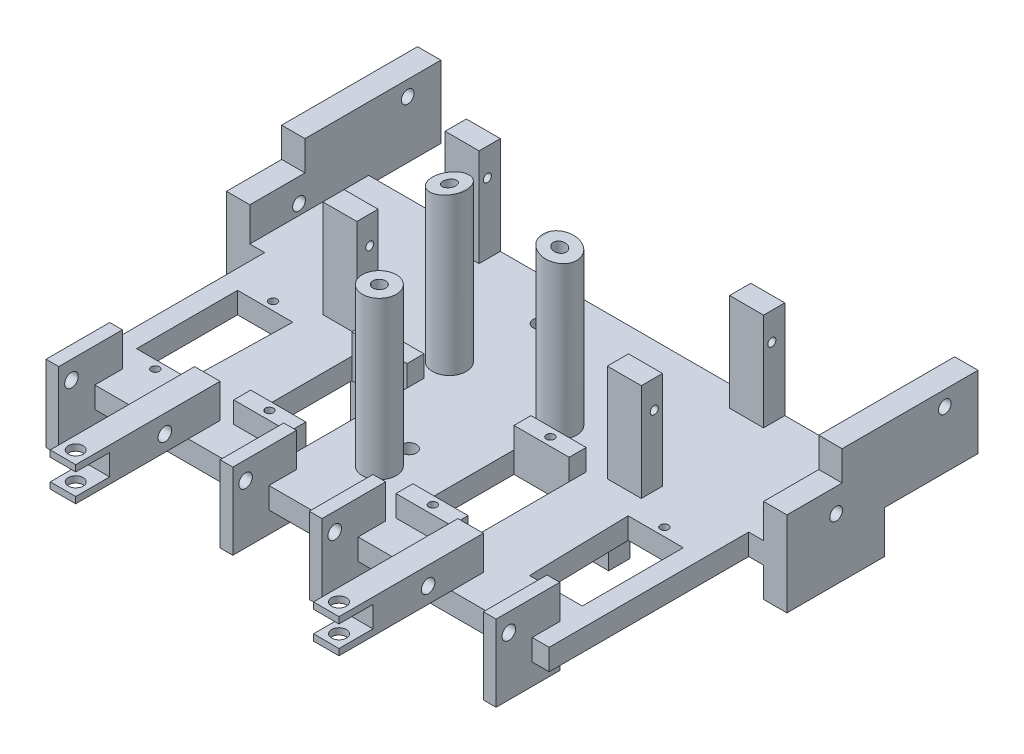
from build123d import *

# Parameters (mm, degrees)
SKETCH_1_W           = 114
SKETCH_1_H           = 75
EXTRUDE_1_DEPTH      = 5
SKETCH_4_W           = 121
SKETCH_4_H           = 28
EXTRUDE_4_DEPTH      = 5
SKETCH_5_W           = 23
SKETCH_5_H           = 20
EXTRUDE_5_DEPTH      = 5.5
SKETCH_6_W           = 32
SKETCH_6_H           = 17
EXTRUDE_6_DEPTH      = 5.5
SKETCH_8_W           = 8
SKETCH_8_H           = 5
EXTRUDE_7_DEPTH      = 23
EXTRUDE_START        = -10
SKETCH_9_W           = 3
SKETCH_9_H           = 15
EXTRUDE_8_DEPTH      = 18
SKETCH_10_W          = 3
SKETCH_10_H          = 15
EXTRUDE_9_DEPTH      = 18
SKETCH_11_W          = 6
SKETCH_11_H          = 34
EXTRUDE_10_DEPTH     = 8
SKETCH_12_R          = 4
EXTRUDE_11_DEPTH     = 37
CUT_EXTRUDE_8_REACH  = 126.354
SKETCH_19_R          = 0.95
SKETCH_25_R          = 4
EXTRUDE_14_DEPTH     = 37
CUT_EXTRUDE_14_DEPTH = 36
SKETCH_28_W          = 6
SKETCH_28_H          = 5
CUT_EXTRUDE_16_DEPTH = 8
SKETCH_29_R          = 1.75
CUT_EXTRUDE_17_DEPTH = 8
SKETCH_30_R          = 1.6
CUT_EXTRUDE_18_DEPTH = 48
SKETCH_31_R          = 1.75
CUT_EXTRUDE_19_DEPTH = 20
SKETCH_35_R          = 1.5
CUT_EXTRUDE_23_DEPTH = 15
SKETCH_36_R          = 0.95
SKETCH_36_W          = 13
SKETCH_36_H          = 23.8
CUT_EXTRUDE_24_DEPTH = 7
SKETCH_37_W          = 6
SKETCH_37_H          = 5
SKETCH_37_W_2        = 5.306431403
EXTRUDE_15_DEPTH     = 13
SKETCH_38_R          = 0.95
CUT_EXTRUDE_25_DEPTH = 13
SKETCH_43_W          = 33.306431403
SKETCH_43_H          = 36.401816986
SKETCH_43_W_2        = 5.306431403
SKETCH_43_H_2        = 5
SKETCH_43_W_3        = 6
CUT_EXTRUDE_28_DEPTH = 2
EXTRUDE_START_2      = 5
SKETCH_41_W          = 13
SKETCH_41_H          = 4
SKETCH_41_R          = 0.95
EXTRUDE_16_DEPTH     = 5
CUT_EXTRUDE_START    = -13
SKETCH_39_R          = 1.5
CUT_EXTRUDE_26_DEPTH = 55


with BuildPart() as part:
    # 草图1 → 凸台-拉伸1 (new body)
    with BuildSketch(Plane(origin=(0, 0, 0), x_dir=(1, 0, 0), z_dir=(0, 1, 0))):
        Rectangle(SKETCH_1_W, SKETCH_1_H)
    extrude(amount=EXTRUDE_1_DEPTH)

    # 草图4 → 凸台-拉伸4 (add)
    with BuildSketch(Plane(origin=(0, 5, 0), x_dir=(1, 0, 0), z_dir=(0, 1, 0))):
        with Locations((0, 23.5)):
            Rectangle(SKETCH_4_W, SKETCH_4_H)
    extrude(amount=-EXTRUDE_4_DEPTH)

    # 草图5 → 凸台-拉伸5 (add)
    with BuildSketch(Plane.ZY.offset(60.5)):
        with Locations((-21, 3)):
            Rectangle(SKETCH_5_W, SKETCH_5_H)
    extrude_5 = extrude(amount=EXTRUDE_5_DEPTH)

    # 草图6 → 凸台-拉伸6 (add)
    with BuildSketch(Plane.ZY.offset(60.5)):
        with Locations((-38.5, 11.5)):
            Rectangle(SKETCH_6_W, SKETCH_6_H)
    extrude_6 = extrude(amount=EXTRUDE_6_DEPTH)

    # 草图8 → 凸台-拉伸7 (add)
    with BuildSketch(Plane(origin=(0, 5, 0), x_dir=(1, 0, 0), z_dir=(0, 1, 0))):
        with Locations((-33.5, 35)):
            Rectangle(SKETCH_8_W, SKETCH_8_H)
        with Locations((-33.5, 6.2)):
            Rectangle(SKETCH_8_W, SKETCH_8_H)
    extrude_7 = extrude(amount=EXTRUDE_7_DEPTH)

    # 草图9 → 凸台-拉伸8 (add)
    with BuildSketch(Plane(origin=(0, 5, 0), x_dir=(1, 0, 0), z_dir=(0, 1, 0)).offset(EXTRUDE_START)):
        with Locations((-10.5, -38.5)):
            Rectangle(SKETCH_9_W, SKETCH_9_H)
    extrude_8 = extrude(amount=EXTRUDE_8_DEPTH)

    # 草图10 → 凸台-拉伸9 (add)
    with BuildSketch(Plane(origin=(0, 5, 0), x_dir=(1, 0, 0), z_dir=(0, 1, 0)).offset(EXTRUDE_START)):
        with Locations((-51.5, -38.5)):
            Rectangle(SKETCH_10_W, SKETCH_10_H)
    extrude_9 = extrude(amount=EXTRUDE_9_DEPTH)

    # 草图11 → 凸台-拉伸10 (add)
    with BuildSketch(Plane(origin=(0, 5, 0), x_dir=(1, 0, 0), z_dir=(0, 1, 0))):
        with Locations((-31, -47)):
            Rectangle(SKETCH_11_W, SKETCH_11_H)
    extrude_10 = extrude(amount=EXTRUDE_10_DEPTH)

    # 草图12 → 凸台-拉伸11 (add)
    with BuildSketch(Plane(origin=(0, 5, 0), x_dir=(1, 0, 0), z_dir=(0, 1, 0))):
        with Locations(Location((-13, 9, 0), (0, 0, 270))):
            Circle(SKETCH_12_R)
    extrude_11 = extrude(amount=EXTRUDE_11_DEPTH)

    # 草图19 → 切除-拉伸8 (cut, up to next)
    with BuildSketch(Plane.ZY.offset(37.5), mode=Mode.PRIVATE) as cut_extrude_8_sk1:
        with Locations((-6.75, 21.5)):
            Circle(SKETCH_19_R)
    cut_extrude_8_tool1 = extrude(cut_extrude_8_sk1.sketch, amount=-CUT_EXTRUDE_8_REACH, mode=Mode.PRIVATE) & part.part
    # 草图19 → 切除-拉伸8 (cut, up to next)
    with BuildSketch(Plane.ZY.offset(37.5), mode=Mode.PRIVATE) as cut_extrude_8_sk2:
        with Locations((-34.45, 21.5)):
            Circle(SKETCH_19_R)
    cut_extrude_8_tool2 = extrude(cut_extrude_8_sk2.sketch, amount=-CUT_EXTRUDE_8_REACH, mode=Mode.PRIVATE) & part.part
    cut_extrude_8_1 = cut_extrude_8_tool1.solids().sort_by_distance((-37.5, 21.5, -6.75))[0]
    add(cut_extrude_8_1, mode=Mode.SUBTRACT)
    cut_extrude_8_2 = cut_extrude_8_tool2.solids().sort_by_distance((-37.5, 21.5, -34.45))[0]
    add(cut_extrude_8_2, mode=Mode.SUBTRACT)
    cut_extrude_8 = cut_extrude_8_1 + cut_extrude_8_2  # 切除-拉伸8 as one shape, for the pattern or mirror that repeats it

    # 草图25 → 凸台-拉伸14 (add)
    with BuildSketch(Plane(origin=(0, 5, 0), x_dir=(1, 0, 0), z_dir=(0, 1, 0))):
        with Locations(Location((0, -20.5, 0), (0, 0, 270))):
            Circle(SKETCH_25_R)
    extrude(amount=EXTRUDE_14_DEPTH)

    # 草图26 → 切除-拉伸14 (cut)
    with BuildSketch(Plane.XY):
        Polygon((-17, 42), (-17, 40.644045518), (-9.31, 42), align=None)
    cut_extrude_14 = extrude(amount=-CUT_EXTRUDE_14_DEPTH, mode=Mode.SUBTRACT)

    # 草图28 → 切除-拉伸16 (cut)
    with BuildSketch(Plane.XY.offset(64)):
        with Locations((-31, 9)):
            Rectangle(SKETCH_28_W, SKETCH_28_H)
    cut_extrude_16 = extrude(amount=-CUT_EXTRUDE_16_DEPTH, mode=Mode.SUBTRACT)

    # 草图29 → 切除-拉伸17 (cut)
    with BuildSketch(Plane(origin=(0, 13, 0), x_dir=(1, 0, 0), z_dir=(0, 1, 0))):
        with Locations(Location((-31, -61, 0), (0, 0, 270))):
            Circle(SKETCH_29_R)
    cut_extrude_17 = extrude(amount=-CUT_EXTRUDE_17_DEPTH, mode=Mode.SUBTRACT)

    # 草图30 → 切除-拉伸18 (cut)
    with BuildSketch(Plane.ZY.offset(53)):
        with Locations((43, 8.75)):
            Circle(SKETCH_30_R)
    cut_extrude_18 = extrude(amount=-CUT_EXTRUDE_18_DEPTH, mode=Mode.SUBTRACT)

    # 草图31 → 切除-拉伸19 (cut)
    with BuildSketch(Plane(origin=(0, 5, 0), x_dir=(1, 0, 0), z_dir=(0, 1, 0))):
        with Locations(Location((0, -13.5, 0), (0, 0, 270))):
            Circle(SKETCH_31_R)
        with Locations(Location((-10, 27.5, 0), (0, 0, 270))):
            Circle(SKETCH_31_R)
        with Locations(Location((10, 27.5, 0), (0, 0, 270))):
            Circle(SKETCH_31_R)
    extrude(amount=-CUT_EXTRUDE_19_DEPTH, mode=Mode.SUBTRACT)

    # 草图35 → 切除-拉伸23 (cut)
    with BuildSketch(Plane.ZY.offset(66)):
        with Locations((-46.688415906, 16.452713274)):
            Circle(SKETCH_35_R)
        with Locations((-21.089366767, 7.437765567)):
            Circle(SKETCH_35_R)
    cut_extrude_23 = extrude(amount=-CUT_EXTRUDE_23_DEPTH, mode=Mode.SUBTRACT)

    # 草图36 → 切除-拉伸24 (cut)
    with BuildSketch(Plane(origin=(0, 5, 0), x_dir=(1, 0, 0), z_dir=(0, 1, 0))):
        with Locations(Location((-19.235936503, 0.562374715, 0), (0, 0, 270))):
            Circle(SKETCH_36_R)
        with Locations(Location((-19.235936503, -27.137625285, 0), (0, 0, 270))):
            Circle(SKETCH_36_R)
        with Locations(Location((-46.126458876, -27.137625285, 0), (0, 0, 270))):
            Circle(SKETCH_36_R)
        with Locations(Location((-46.077391501, 0.562374715, 0), (0, 0, 270))):
            Circle(SKETCH_36_R)
        with Locations((-19.100982802, -13.287625285)):
            Rectangle(SKETCH_36_W, SKETCH_36_H)
        Polygon((-39.491502346, -1.387625285), (-40.053713186, -25.187625285), (-52.491502346, -25.187625285), (-52.491502346, -1.387625285), align=None)
    cut_extrude_24 = extrude(amount=-CUT_EXTRUDE_24_DEPTH, mode=Mode.SUBTRACT)

    # 草图37 → 凸台-拉伸15 (add)
    with BuildSketch(Plane.XZ):
        with Locations((-28.121467527, -34.398183014)):
            Rectangle(SKETCH_37_W, SKETCH_37_H)
        with Locations((-27.774683229, -5.598183014)):
            Rectangle(SKETCH_37_W_2, SKETCH_37_H)
    extrude_15 = extrude(amount=EXTRUDE_15_DEPTH)

    # 草图38 → 切除-拉伸25 (cut)
    with BuildSketch(Plane.ZY.offset(31.121467527)):
        with Locations((-33.848183014, -4.5)):
            Circle(SKETCH_38_R)
        with Locations((-6.148183014, -4.5)):
            Circle(SKETCH_38_R)
    cut_extrude_25 = extrude(amount=-CUT_EXTRUDE_25_DEPTH, mode=Mode.SUBTRACT)

    # 草图43 → 切除-拉伸28 (cut)
    with BuildSketch(Plane.XZ):
        with Locations((-33.774683229, -19.299091507)):
            Rectangle(SKETCH_43_W, SKETCH_43_H)
        with Locations((-27.774683229, -5.598183014)):
            Rectangle(SKETCH_43_W_2, SKETCH_43_H_2, mode=Mode.SUBTRACT)
        with Locations((-28.121467527, -34.398183014)):
            Rectangle(SKETCH_43_W_3, SKETCH_43_H_2, mode=Mode.SUBTRACT)
    cut_extrude_28 = extrude(amount=-CUT_EXTRUDE_28_DEPTH, mode=Mode.SUBTRACT)

    # 草图41 → 凸台-拉伸16 (add)
    # profile 1 of 2: a face of its own
    with BuildSketch(Plane(origin=(0, 5, 0), x_dir=(1, 0, 0), z_dir=(0, 1, 0)).offset(EXTRUDE_START_2)):
        with Locations((-19.100982802, 0.612374715)):
            Rectangle(SKETCH_41_W, SKETCH_41_H)
        with Locations(Location((-19.235936503, 0.562374715, 0), (0, 0, 270))):
            Circle(SKETCH_41_R, mode=Mode.SUBTRACT)
    # profile 2 of 2: a face of its own
    with BuildSketch(Plane(origin=(0, 5, 0), x_dir=(1, 0, 0), z_dir=(0, 1, 0)).offset(EXTRUDE_START_2)):
        with Locations((-19.100982802, -27.187625285)):
            Rectangle(SKETCH_41_W, SKETCH_41_H)
        with Locations(Location((-19.235936503, -27.137625285, 0), (0, 0, 270))):
            Circle(SKETCH_41_R, mode=Mode.SUBTRACT)
    extrude_16 = extrude(amount=-EXTRUDE_16_DEPTH)

    # 草图39 → 切除-拉伸26 (cut)
    with BuildSketch(Plane(origin=(0, 5, 0), x_dir=(1, 0, 0), z_dir=(0, 1, 0)).offset(CUT_EXTRUDE_START)):
        with Locations(Location((-13, 9, 0), (0, 0, 180))):
            Circle(SKETCH_39_R)
        with Locations(Location((0, -20.5, 0), (0, 0, 270))):
            Circle(SKETCH_39_R)
    cut_extrude_26 = extrude(amount=CUT_EXTRUDE_26_DEPTH, mode=Mode.SUBTRACT)

    # 镜向1: 凸台-拉伸5, 凸台-拉伸6, 凸台-拉伸7, 凸台-拉伸8, 凸台-拉伸9, 凸台-拉伸10, 凸台-拉伸11, 切除-拉伸8, 切除-拉伸14, 切除-拉伸16, 切除-拉伸17, 切除-拉伸18, 切除-拉伸23, 切除-拉伸24, 凸台-拉伸15, 切除-拉伸25, 切除-拉伸28, 凸台-拉伸16, 切除-拉伸26 across plane
    add(extrude_5.mirror(Plane(origin=(0, 0, 0), x_dir=(0, 0, 1), z_dir=(1, 0, 0))))
    add(extrude_6.mirror(Plane(origin=(0, 0, 0), x_dir=(0, 0, 1), z_dir=(1, 0, 0))))
    add(extrude_7.mirror(Plane(origin=(0, 0, 0), x_dir=(0, 0, 1), z_dir=(1, 0, 0))))
    add(extrude_8.mirror(Plane(origin=(0, 0, 0), x_dir=(0, 0, 1), z_dir=(1, 0, 0))))
    add(extrude_9.mirror(Plane(origin=(0, 0, 0), x_dir=(0, 0, 1), z_dir=(1, 0, 0))))
    add(extrude_10.mirror(Plane(origin=(0, 0, 0), x_dir=(0, 0, 1), z_dir=(1, 0, 0))))
    add(extrude_11.mirror(Plane(origin=(0, 0, 0), x_dir=(0, 0, 1), z_dir=(1, 0, 0))))
    add(cut_extrude_8.mirror(Plane(origin=(0, 0, 0), x_dir=(0, 0, 1), z_dir=(1, 0, 0))), mode=Mode.SUBTRACT)
    add(cut_extrude_14.mirror(Plane(origin=(0, 0, 0), x_dir=(0, 0, 1), z_dir=(1, 0, 0))), mode=Mode.SUBTRACT)
    add(cut_extrude_16.mirror(Plane(origin=(0, 0, 0), x_dir=(0, 0, 1), z_dir=(1, 0, 0))), mode=Mode.SUBTRACT)
    add(cut_extrude_17.mirror(Plane(origin=(0, 0, 0), x_dir=(0, 0, 1), z_dir=(1, 0, 0))), mode=Mode.SUBTRACT)
    add(cut_extrude_18.mirror(Plane(origin=(0, 0, 0), x_dir=(0, 0, 1), z_dir=(1, 0, 0))), mode=Mode.SUBTRACT)
    add(cut_extrude_23.mirror(Plane(origin=(0, 0, 0), x_dir=(0, 0, 1), z_dir=(1, 0, 0))), mode=Mode.SUBTRACT)
    add(cut_extrude_24.mirror(Plane(origin=(0, 0, 0), x_dir=(0, 0, 1), z_dir=(1, 0, 0))), mode=Mode.SUBTRACT)
    add(extrude_15.mirror(Plane(origin=(0, 0, 0), x_dir=(0, 0, 1), z_dir=(1, 0, 0))))
    add(cut_extrude_25.mirror(Plane(origin=(0, 0, 0), x_dir=(0, 0, 1), z_dir=(1, 0, 0))), mode=Mode.SUBTRACT)
    add(cut_extrude_28.mirror(Plane(origin=(0, 0, 0), x_dir=(0, 0, 1), z_dir=(1, 0, 0))), mode=Mode.SUBTRACT)
    add(extrude_16.mirror(Plane(origin=(0, 0, 0), x_dir=(0, 0, 1), z_dir=(1, 0, 0))))
    add(cut_extrude_26.mirror(Plane(origin=(0, 0, 0), x_dir=(0, 0, 1), z_dir=(1, 0, 0))), mode=Mode.SUBTRACT)


solid = part.part
